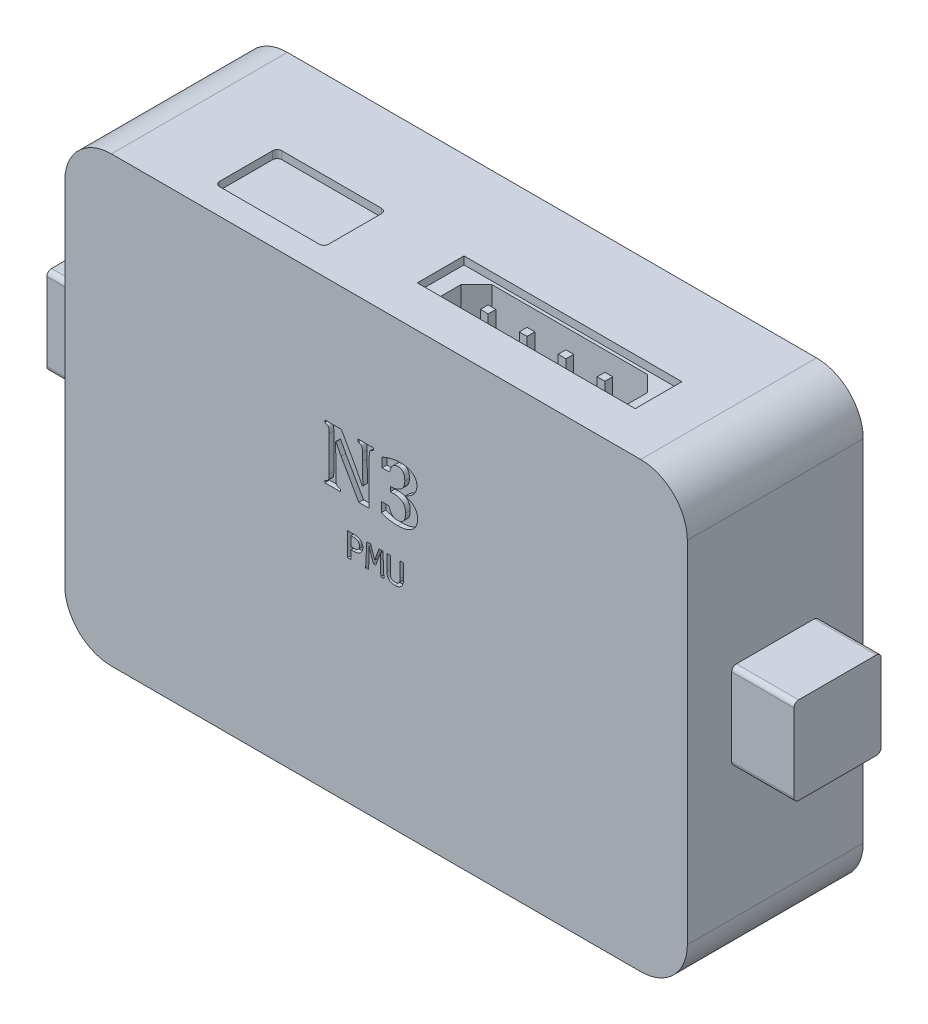
from build123d import *

# Parameters (mm, degrees)
EXTRUDE_1_DEPTH     = 5.65
CUT_EXTRUDE_3_DEPTH = 0.3
EXTRUDE_3_DEPTH     = 4
EXTRUDE_START       = 4
EXTRUDE_4_DEPTH     = 4
UP_CAN_W            = 0.5
UP_CAN_H            = 0.5
CUT_EXTRUDE_5_DEPTH = 4
UP_CAN_3_W          = 14
UP_CAN_3_H          = 3
CUT_EXTRUDE_6_DEPTH = 0.5
CUT_EXTRUDE_7_DEPTH = 0.5


with BuildPart() as part:
    # Main → 凸台-拉伸1 (new, symmetric)
    with BuildSketch(Plane.XY):
        with BuildLine():
            Line((-20, 11.25), (-20, -11.25))
            ThreePointArc((-20, -11.25), (-19.121320344, -13.371320344), (-17, -14.25))
            Line((-17, -14.25), (17, -14.25))
            ThreePointArc((17, -14.25), (19.121320344, -13.371320344), (20, -11.25))
            Line((20, -11.25), (20, 11.25))
            ThreePointArc((20, 11.25), (19.121320344, 13.371320344), (17, 14.25))
            Line((17, 14.25), (-17, 14.25))
            ThreePointArc((-17, 14.25), (-19.121320344, 13.371320344), (-20, 11.25))
        make_face()
    extrude(amount=EXTRUDE_1_DEPTH, both=True)

    # 草图3 → 切除-拉伸3 (cut)
    # profile 1 of 5: a face of its own
    with BuildSketch(Plane.XY.offset(5.65)):
        with BuildLine():
            Line((-0.161653646, 6.307201292), (-0.161653646, 6.161367958))
            add(Edge.make_bspline(
                [(-0.161653646, 6.161367958), (-0.177669577, 6.156235476), (-0.207122243, 6.146797044), (-0.246900488, 6.131171507), (-0.279469724, 6.117829548), (-0.312906932, 6.102024058), (-0.347427448, 6.079192462), (-0.382321405, 6.042359658), (-0.408955266, 5.989839407), (-0.422918392, 5.933915635), (-0.431549055, 5.877250432), (-0.435554473, 5.821903546), (-0.438778121, 5.756314202), (-0.438850306, 5.708935976), (-0.438888889, 5.683611882)],
                knots=[0, 0, 0, 0, 0.975471235, 1.79385316, 2.478592115, 3.017303699, 3.938041953, 4.862988783, 5.927517867, 7.313751775, 8.190433857, 9.251714942, 10.531016607, 12, 12, 12, 12], degree=3))
            Line((-0.438888889, 5.683611882), (-0.438888889, 2.807201292))
            Line((-0.438888889, 2.807201292), (-1.109570312, 2.807201292))
            Line((-1.109570312, 2.807201292), (-2.243576389, 4.802535493))
            add(Edge.make_bspline(
                [(-2.243576389, 4.802535493), (-2.262061977, 4.835447234), (-2.297864844, 4.899190661), (-2.349981257, 4.992106588), (-2.397397164, 5.079949418), (-2.44170538, 5.162098586), (-2.48201379, 5.238793118), (-2.518234642, 5.310060445), (-2.551426649, 5.375634633), (-2.571291416, 5.417976185), (-2.580815972, 5.438277681)],
                knots=[0, 0, 0, 0, 1.258598321, 2.437651948, 3.551981321, 4.586832213, 5.549698172, 6.440681917, 7.252354063, 8, 8, 8, 8], degree=3))
            Line((-2.580815972, 5.438277681), (-2.603602431, 5.438277681))
            add(Edge.make_bspline(
                [(-2.603602431, 5.438277681), (-2.599591716, 5.344101724), (-2.59147488, 5.153509518), (-2.583113042, 4.863596326), (-2.578672736, 4.566077264), (-2.578078581, 4.365036897), (-2.577777778, 4.263255979)],
                knots=[0, 0, 0, 0, 0.96232484, 1.947541814, 2.960899847, 4, 4, 4, 4], degree=3))
            Line((-2.577777778, 4.263255979), (-2.577777778, 3.429271604))
            add(Edge.make_bspline(
                [(-2.577777778, 3.429271604), (-2.577360248, 3.3993976), (-2.576592183, 3.344442964), (-2.574303843, 3.269114776), (-2.568298325, 3.208262066), (-2.558638799, 3.148057851), (-2.535177858, 3.088657172), (-2.499072994, 3.039184043), (-2.457295753, 3.009644248), (-2.414642197, 2.989790918), (-2.361461312, 2.970255391), (-2.321902365, 2.959072708), (-2.300542535, 2.953034625)],
                knots=[0, 0, 0, 0, 1.438978439, 2.647068478, 3.627372042, 4.383140196, 5.576371536, 6.671434312, 7.273846566, 8.020909247, 8.931391092, 10, 10, 10, 10], degree=3))
            Line((-2.300542535, 2.953034625), (-2.300542535, 2.807201292))
            Line((-2.300542535, 2.807201292), (-3.289474826, 2.807201292))
            Line((-3.289474826, 2.807201292), (-3.289474826, 2.953034625))
            add(Edge.make_bspline(
                [(-3.289474826, 2.953034625), (-3.260887566, 2.961497722), (-3.209575028, 2.976688508), (-3.141898216, 3.006316915), (-3.089109373, 3.043258296), (-3.054582463, 3.09524769), (-3.031805913, 3.157665661), (-3.021267721, 3.234246943), (-3.015577407, 3.326622957), (-3.015384102, 3.394316413), (-3.015277778, 3.43155025)],
                knots=[0, 0, 0, 0, 1.149089374, 2.062551405, 2.843955622, 3.594533422, 4.429073491, 5.389328747, 6.564036866, 8, 8, 8, 8], degree=3))
            Line((-3.015277778, 3.43155025), (-3.015277778, 5.682852333))
            add(Edge.make_bspline(
                [(-3.015277778, 5.682852333), (-3.015325243, 5.712984528), (-3.015411829, 5.767951257), (-3.018334, 5.842952579), (-3.023087242, 5.90261003), (-3.032403199, 5.961298476), (-3.054104254, 6.020961153), (-3.091783318, 6.070329356), (-3.134117609, 6.101486773), (-3.176190741, 6.124119037), (-3.229205053, 6.144216392), (-3.268362891, 6.155359926), (-3.289474826, 6.161367958)],
                knots=[0, 0, 0, 0, 1.453211759, 2.650928568, 3.61941141, 4.338124492, 5.512963293, 6.643955544, 7.271627919, 8.036671964, 8.941472357, 10, 10, 10, 10], degree=3))
            Line((-3.289474826, 6.161367958), (-3.289474826, 6.307201292))
            Line((-3.289474826, 6.307201292), (-2.231423611, 6.307201292))
            Line((-2.231423611, 6.307201292), (-1.341232639, 4.730378375))
            add(Edge.make_bspline(
                [(-1.341232639, 4.730378375), (-1.326281235, 4.7032955), (-1.29419107, 4.645167585), (-1.242753958, 4.551273836), (-1.186516622, 4.443784926), (-1.103399271, 4.286116126), (-1.000819197, 4.087585766), (-0.925038386, 3.926245406), (-0.888541667, 3.848542438)],
                knots=[0, 0, 0, 0, 0.561655796, 1.205480602, 1.943652644, 2.764033489, 4.441529425, 6, 6, 6, 6], degree=3))
            Line((-0.888541667, 3.848542438), (-0.84828559, 3.848542438))
            add(Edge.make_bspline(
                [(-0.84828559, 3.848542438), (-0.852568567, 3.954111504), (-0.86132807, 4.170020345), (-0.870286692, 4.500951891), (-0.875728167, 4.846064107), (-0.876165667, 5.080781371), (-0.876388889, 5.200538965)],
                knots=[0, 0, 0, 0, 0.937488971, 1.917343447, 2.937385629, 4, 4, 4, 4], degree=3))
            Line((-0.876388889, 5.200538965), (-0.876388889, 5.682092785))
            add(Edge.make_bspline(
                [(-0.876388889, 5.682092785), (-0.8765491, 5.708169682), (-0.876846263, 5.756537763), (-0.878584804, 5.823462371), (-0.88341317, 5.878643439), (-0.889470731, 5.934140454), (-0.902414163, 5.98793051), (-0.926402611, 6.039529138), (-0.960023933, 6.077406474), (-0.994463834, 6.101933675), (-1.029168865, 6.118696756), (-1.062773812, 6.132948963), (-1.104258254, 6.147203198), (-1.134351907, 6.156404379), (-1.150585937, 6.161367958)],
                knots=[0, 0, 0, 0, 1.50660748, 2.794493175, 3.865833101, 4.705810794, 6.018377177, 7.045366401, 7.95762345, 8.91149549, 9.467497486, 10.181957038, 11.019256184, 12, 12, 12, 12], degree=3))
            Line((-1.150585937, 6.161367958), (-1.150585937, 6.307201292))
            Line((-1.150585937, 6.307201292), (-0.161653646, 6.307201292))
        make_face()
    # profile 2 of 5: a face of its own
    with BuildSketch(Plane.XY.offset(5.65)):
        with BuildLine():
            Line((0.3875, 5.480812403), (0.3875, 6.081615354))
            add(Edge.make_bspline(
                [(0.3875, 6.081615354), (0.440740019, 6.103601001), (0.544910562, 6.14661858), (0.701382153, 6.202099733), (0.853924181, 6.249254445), (1.002588814, 6.288280461), (1.147644136, 6.318087232), (1.288859262, 6.339330677), (1.426551741, 6.352907397), (1.517172623, 6.354854393), (1.561762153, 6.355812403)],
                knots=[0, 0, 0, 0, 1.138871734, 2.228340433, 3.281437788, 4.295392059, 5.266464412, 6.20817041, 7.11833965, 8, 8, 8, 8], degree=3))
            add(Edge.make_bspline(
                [(1.561762153, 6.355812403), (1.612700862, 6.35491021), (1.711831349, 6.353154476), (1.855946997, 6.336134858), (1.991078637, 6.308416711), (2.116218264, 6.268988265), (2.230784195, 6.220083374), (2.332778472, 6.160594215), (2.419627815, 6.088560036), (2.493671249, 6.00797799), (2.55197375, 5.916475895), (2.594306505, 5.815954645), (2.619025084, 5.705807484), (2.62204951, 5.629557521), (2.623611111, 5.590187403)],
                knots=[0, 0, 0, 0, 1.245991689, 2.424791773, 3.545045706, 4.616816666, 5.629595787, 6.587952593, 7.494614438, 8.380594144, 9.255347842, 10.135547138, 11.037327689, 12, 12, 12, 12], degree=3))
            add(Edge.make_bspline(
                [(2.623611111, 5.590187403), (2.622735968, 5.554158468), (2.621031018, 5.483967056), (2.60351275, 5.382098916), (2.57681259, 5.286355946), (2.537203389, 5.197839213), (2.48900985, 5.115118381), (2.431899461, 5.037975403), (2.364854414, 4.966985957), (2.289034787, 4.900407347), (2.202470426, 4.837907658), (2.105401044, 4.776379887), (1.996821144, 4.714672001), (1.91897061, 4.676532146), (1.878493924, 4.65670216)],
                knots=[0, 0, 0, 0, 1.018223358, 1.983698243, 2.915322269, 3.82284993, 4.718315375, 5.619291428, 6.531357531, 7.475260989, 8.469397413, 9.548207294, 10.725243872, 12, 12, 12, 12], degree=3))
            Line((1.878493924, 4.65670216), (1.878493924, 4.633915702))
            add(Edge.make_bspline(
                [(1.878493924, 4.633915702), (1.914332461, 4.626665135), (1.985268492, 4.612313923), (2.088345737, 4.58050901), (2.185825078, 4.538021245), (2.278699343, 4.488413353), (2.364496749, 4.429562042), (2.441580147, 4.36095619), (2.509481243, 4.283301538), (2.567266491, 4.196173322), (2.614853742, 4.101384943), (2.648343733, 3.998239694), (2.668374432, 3.887805197), (2.670917252, 3.811663393), (2.672222222, 3.772587577)],
                knots=[0, 0, 0, 0, 1.026010526, 2.030805963, 3.020916541, 4.0067071, 4.98253303, 5.933933234, 6.895997563, 7.869724968, 8.861364754, 9.863719257, 10.903665134, 12, 12, 12, 12], degree=3))
            add(Edge.make_bspline(
                [(2.672222222, 3.772587577), (2.670475833, 3.724864282), (2.66704771, 3.631184483), (2.639892184, 3.494771243), (2.594916044, 3.366473079), (2.541926714, 3.267301201), (2.491221993, 3.19285027), (2.448082435, 3.140191446), (2.400660821, 3.090064791), (2.347753383, 3.044029038), (2.291156171, 2.999707699), (2.229135573, 2.959567038), (2.162916446, 2.922302126), (2.067455524, 2.87609179), (1.936808858, 2.828026797), (1.766553096, 2.787465527), (1.580692314, 2.763117955), (1.451703991, 2.760136765), (1.384787326, 2.758590181)],
                knots=[0, 0, 0, 0, 1.238691166, 2.431524098, 3.596131476, 4.758044184, 5.339846471, 5.93341988, 6.524072501, 7.129652346, 7.75306838, 8.389559096, 9.046112197, 9.725450149, 11.142277535, 12.650970423, 14.262587788, 16, 16, 16, 16], degree=3))
            add(Edge.make_bspline(
                [(1.384787326, 2.758590181), (1.33716922, 2.759092718), (1.242335341, 2.760093546), (1.100704382, 2.77068084), (0.960201974, 2.786104278), (0.822458508, 2.809197191), (0.689307329, 2.836258219), (0.564478721, 2.871187031), (0.447273325, 2.907813905), (0.374357917, 2.939258022), (0.338888889, 2.954553722)],
                knots=[0, 0, 0, 0, 1.066585531, 2.124159315, 3.180226203, 4.232065357, 5.252166273, 6.22223498, 7.135222593, 8, 8, 8, 8], degree=3))
            Line((0.338888889, 2.954553722), (0.338888889, 3.58497907))
            Line((0.338888889, 3.58497907), (0.825, 3.58497907))
            add(Edge.make_bspline(
                [(0.825, 3.58497907), (0.837189747, 3.541105853), (0.860202393, 3.458278966), (0.907565053, 3.345919547), (0.960730451, 3.251565392), (1.023417455, 3.176118777), (1.096067092, 3.1186378), (1.17921829, 3.079163153), (1.27189704, 3.053713903), (1.337265875, 3.051436264), (1.371115451, 3.050256847)],
                knots=[0, 0, 0, 0, 1.305930177, 2.46542516, 3.491309853, 4.404185451, 5.263440125, 6.128056862, 7.030662191, 8, 8, 8, 8], degree=3))
            add(Edge.make_bspline(
                [(1.371115451, 3.050256847), (1.392164121, 3.050525579), (1.433176166, 3.051049186), (1.492609065, 3.059994493), (1.548059007, 3.072660712), (1.599916425, 3.08987362), (1.646929411, 3.113950828), (1.690785253, 3.141776376), (1.729796272, 3.17587504), (1.765072714, 3.214651632), (1.795252278, 3.259235831), (1.822079278, 3.308261952), (1.84498521, 3.362385836), (1.86284081, 3.422079304), (1.877484799, 3.486747686), (1.886829861, 3.556659277), (1.893110212, 3.631450873), (1.893990014, 3.682946718), (1.894444444, 3.709545042)],
                knots=[0, 0, 0, 0, 1.04932923, 2.044553753, 2.991534269, 3.886518749, 4.762302477, 5.620875306, 6.471885114, 7.33961212, 8.229767994, 9.151377203, 10.125200033, 11.156267991, 12.256683227, 13.430583075, 14.672860224, 16, 16, 16, 16], degree=3))
            add(Edge.make_bspline(
                [(1.894444444, 3.709545042), (1.893923242, 3.738186103), (1.89291031, 3.793848689), (1.883337619, 3.874279752), (1.86974041, 3.949330349), (1.847881869, 4.01803446), (1.821530947, 4.08166875), (1.788878631, 4.139746911), (1.749657985, 4.191956714), (1.704456283, 4.238582024), (1.653392593, 4.280010236), (1.595481177, 4.314755171), (1.532454678, 4.345537522), (1.462480649, 4.369654454), (1.386682245, 4.388295691), (1.304717529, 4.402234305), (1.216545131, 4.409308719), (1.155667314, 4.410667171), (1.124262153, 4.411367958)],
                knots=[0, 0, 0, 0, 1.148071931, 2.231225072, 3.24480356, 4.201827953, 5.116438562, 6.003060875, 6.866114256, 7.727792825, 8.601530905, 9.494871905, 10.430378815, 11.409816751, 12.456422708, 13.558120058, 14.740302521, 16, 16, 16, 16], degree=3))
            Line((1.124262153, 4.411367958), (0.922222222, 4.411367958))
            Line((0.922222222, 4.411367958), (0.922222222, 4.703034625))
            add(Edge.make_bspline(
                [(0.922222222, 4.703034625), (0.958968977, 4.705139352), (1.030367567, 4.709228815), (1.133861524, 4.722240965), (1.23055265, 4.740320703), (1.320626575, 4.763556545), (1.403485769, 4.793092305), (1.479437046, 4.828332616), (1.548758592, 4.868519375), (1.611744672, 4.91395593), (1.666592564, 4.966251749), (1.714960843, 5.023269571), (1.755313557, 5.08630896), (1.789037602, 5.154188993), (1.814991128, 5.227900214), (1.832889709, 5.306920191), (1.84365028, 5.391396436), (1.845090515, 5.449385024), (1.845833333, 5.479293306)],
                knots=[0, 0, 0, 0, 1.294124326, 2.514471056, 3.665273782, 4.75157949, 5.782351101, 6.754339568, 7.691995305, 8.596689159, 9.478484644, 10.35060716, 11.219952716, 12.103948147, 13.010742687, 13.961079669, 14.948403386, 16, 16, 16, 16], degree=3))
            add(Edge.make_bspline(
                [(1.845833333, 5.479293306), (1.845601673, 5.502594758), (1.845150288, 5.547997268), (1.839954798, 5.613741137), (1.83057941, 5.675058041), (1.818822186, 5.732052988), (1.803003196, 5.784774609), (1.782835695, 5.832799392), (1.760733292, 5.877171582), (1.73337706, 5.916086132), (1.704254924, 5.951346789), (1.670709149, 5.981313719), (1.634583481, 6.007411811), (1.594305126, 6.027641831), (1.551844133, 6.044876462), (1.505510174, 6.05596297), (1.456147632, 6.06293274), (1.422030494, 6.063734567), (1.40453559, 6.064145736)],
                knots=[0, 0, 0, 0, 1.342415624, 2.615675512, 3.795773904, 4.914495864, 5.966655767, 6.960891649, 7.913479791, 8.815817395, 9.695585522, 10.542445334, 11.400538855, 12.255277765, 13.132987386, 14.03520706, 14.992475158, 16, 16, 16, 16], degree=3))
            add(Edge.make_bspline(
                [(1.40453559, 6.064145736), (1.384491939, 6.063635193), (1.344910756, 6.062626999), (1.286744903, 6.052384063), (1.230852682, 6.035654563), (1.177220657, 6.011801627), (1.12508323, 5.980681479), (1.077488635, 5.937936797), (1.032105503, 5.886198705), (0.989775583, 5.824689739), (0.951803541, 5.75319374), (0.920110747, 5.671187624), (0.892637928, 5.57984619), (0.880107507, 5.514625874), (0.873611111, 5.480812403)],
                knots=[0, 0, 0, 0, 0.831492998, 1.641990067, 2.443438678, 3.248189408, 4.073881454, 4.952981561, 5.891417605, 6.926545987, 8.045740153, 9.244265423, 10.571289508, 12, 12, 12, 12], degree=3))
            Line((0.873611111, 5.480812403), (0.3875, 5.480812403))
        make_face()
    # profile 3 of 5: a face of its own
    with BuildSketch(Plane.XY.offset(5.65)):
        with BuildLine():
            add(Edge.make_bspline(
                [(-0.847826087, 0.416844572), (-0.84819317, 0.401649218), (-0.848930636, 0.371121882), (-0.855738904, 0.325548058), (-0.866281469, 0.280218449), (-0.880763763, 0.235431129), (-0.899756752, 0.191847749), (-0.9234907, 0.150245177), (-0.952503811, 0.111404926), (-0.985323881, 0.074500096), (-1.023271409, 0.040770279), (-1.066164851, 0.010379421), (-1.11388272, -0.016677028), (-1.166281838, -0.040753728), (-1.224049093, -0.059647666), (-1.287024222, -0.073668349), (-1.355431007, -0.081685229), (-1.402832275, -0.082654768), (-1.427309783, -0.083155428)],
                knots=[0, 0, 0, 0, 0.84837333, 1.704374698, 2.568122001, 3.446177459, 4.329841521, 5.219461111, 6.115085959, 7.03322926, 7.973947317, 8.94447037, 9.964314875, 11.034235969, 12.160282575, 13.352588404, 14.632904974, 16, 16, 16, 16], degree=3))
            Line((-1.427309783, -0.083155428), (-1.608695652, -0.083155428))
            Line((-1.608695652, -0.083155428), (-1.608695652, -0.626633689))
            Line((-1.608695652, -0.626633689), (-1.826086957, -0.626633689))
            Line((-1.826086957, -0.626633689), (-1.826086957, 0.873366311))
            Line((-1.826086957, 0.873366311), (-1.406589674, 0.873366311))
            add(Edge.make_bspline(
                [(-1.406589674, 0.873366311), (-1.388348098, 0.873173118), (-1.352140258, 0.872789648), (-1.298530288, 0.867656163), (-1.24595711, 0.860424508), (-1.194848716, 0.849613458), (-1.145773697, 0.835429928), (-1.099150438, 0.818117241), (-1.056266715, 0.795536157), (-1.015997662, 0.770232699), (-0.978911032, 0.741023), (-0.946284546, 0.70712553), (-0.917509513, 0.669363297), (-0.892587836, 0.627825076), (-0.872068737, 0.581807134), (-0.858278341, 0.53081996), (-0.849020504, 0.475378026), (-0.848233561, 0.436813189), (-0.847826087, 0.416844572)],
                knots=[0, 0, 0, 0, 1.071095419, 2.126025337, 3.160633674, 4.187194637, 5.191188192, 6.159546808, 7.102471747, 8.032359578, 8.950543616, 9.867691343, 10.788184798, 11.733733012, 12.707489344, 13.737062018, 14.82826569, 16, 16, 16, 16], degree=3))
        make_face()
        with BuildLine():
            add(Edge.make_bspline(
                [(-1.065217391, 0.405295659), (-1.065434245, 0.416860055), (-1.065856902, 0.439399495), (-1.070400235, 0.472041011), (-1.077554701, 0.502638253), (-1.087300118, 0.531164705), (-1.099933708, 0.557705281), (-1.115730491, 0.581896924), (-1.134189983, 0.604244549), (-1.15562493, 0.624221094), (-1.179614177, 0.641805477), (-1.205437631, 0.657700678), (-1.233927854, 0.670545369), (-1.264692857, 0.680957945), (-1.29756274, 0.689613835), (-1.332856198, 0.695061141), (-1.370150823, 0.699105706), (-1.395821206, 0.699335557), (-1.408967391, 0.699453268)],
                knots=[0, 0, 0, 0, 1.07893025, 2.102875295, 3.069403633, 4.00867391, 4.911619206, 5.805799344, 6.69897942, 7.61127936, 8.532960211, 9.47193309, 10.436783978, 11.442898866, 12.50165651, 13.605056338, 14.773513735, 16, 16, 16, 16], degree=3))
            Line((-1.408967391, 0.699453268), (-1.608695652, 0.699453268))
            Line((-1.608695652, 0.699453268), (-1.608695652, 0.090757616))
            Line((-1.608695652, 0.090757616), (-1.426290761, 0.090757616))
            add(Edge.make_bspline(
                [(-1.426290761, 0.090757616), (-1.412244658, 0.091062272), (-1.385016773, 0.091652838), (-1.345272556, 0.094962764), (-1.30797301, 0.100916247), (-1.273287228, 0.109871819), (-1.241065891, 0.120684194), (-1.21125147, 0.133891853), (-1.18399768, 0.149977666), (-1.159090552, 0.16831263), (-1.136701838, 0.189072592), (-1.117686016, 0.212815949), (-1.101229752, 0.238715211), (-1.087853457, 0.267239501), (-1.07784145, 0.29833586), (-1.07032595, 0.331741516), (-1.065857166, 0.367697012), (-1.06543532, 0.392488325), (-1.065217391, 0.405295659)],
                knots=[0, 0, 0, 0, 1.232805628, 2.389751021, 3.4973379, 4.54330244, 5.530003372, 6.477393866, 7.399377973, 8.301660217, 9.187431021, 10.070466494, 10.963674817, 11.874940633, 12.827061481, 13.825105319, 14.876436953, 16, 16, 16, 16], degree=3))
        make_face(mode=Mode.SUBTRACT)
    # profile 4 of 5: a face of its own
    with BuildSketch(Plane.XY.offset(5.65)):
        Polygon((0.503736413, -0.626633689), (0.304347826, -0.626633689), (0.281589674, 0.324453268), (0.27173913, 0.66582555), (0.200747283, 0.46270055), (-0.023777174, -0.148372819), (-0.165081522, -0.148372819), (-0.375679348, 0.439602724), (-0.445652174, 0.66582555), (-0.450407609, 0.30814892), (-0.47826087, -0.626633689), (-0.670855978, -0.626633689), (-0.596127717, 0.873366311), (-0.353940217, 0.873366311), (-0.152173913, 0.29252392), (-0.086956522, 0.096532072), (-0.022758152, 0.29252392), (0.192595109, 0.873366311), (0.441236413, 0.873366311), align=None)
    # profile 5 of 5: a face of its own
    with BuildSketch(Plane.XY.offset(5.65)):
        with BuildLine():
            add(Edge.make_bspline(
                [(1.760869565, -0.105234232), (1.760365653, -0.125403124), (1.759377855, -0.164939402), (1.753031381, -0.222830508), (1.741766426, -0.277713792), (1.72626586, -0.329532061), (1.70608661, -0.377939856), (1.682117177, -0.422952161), (1.653565214, -0.464156537), (1.620965696, -0.501635976), (1.584040711, -0.535015576), (1.543381306, -0.564420078), (1.498761676, -0.589599391), (1.45055646, -0.611184127), (1.398287859, -0.627575333), (1.342543642, -0.64001614), (1.282903192, -0.647063245), (1.241865891, -0.647928435), (1.220788043, -0.648372819)],
                knots=[0, 0, 0, 0, 1.11533168, 2.186340517, 3.215329593, 4.209637775, 5.172397981, 6.11082755, 7.024364469, 7.938480506, 8.851566745, 9.770835784, 10.707404611, 11.680049096, 12.68592053, 13.731069016, 14.834616795, 16, 16, 16, 16], degree=3))
            add(Edge.make_bspline(
                [(1.220788043, -0.648372819), (1.197786509, -0.647923833), (1.153600781, -0.647061335), (1.08994305, -0.640310155), (1.031718513, -0.628881716), (0.978599395, -0.613029084), (0.930752212, -0.592489742), (0.887561283, -0.568268154), (0.848868581, -0.540397585), (0.814923398, -0.508478152), (0.785540125, -0.472943103), (0.760738306, -0.433904199), (0.739751961, -0.391716976), (0.723254861, -0.346086886), (0.710827523, -0.297467539), (0.702104836, -0.246110614), (0.696478374, -0.192090034), (0.695931628, -0.155067588), (0.695652174, -0.136144558)],
                knots=[0, 0, 0, 0, 1.312563004, 2.521420972, 3.648051293, 4.694693708, 5.678954229, 6.613532698, 7.515738083, 8.393474785, 9.265531829, 10.140290115, 11.027490559, 11.949473662, 12.903968408, 13.887719697, 14.920364614, 16, 16, 16, 16], degree=3))
            Line((0.695652174, -0.136144558), (0.695652174, 0.873366311))
            Line((0.695652174, 0.873366311), (0.913043478, 0.873366311))
            Line((0.913043478, 0.873366311), (0.913043478, -0.118141841))
            add(Edge.make_bspline(
                [(0.913043478, -0.118141841), (0.913222298, -0.132414306), (0.913567608, -0.15997516), (0.916690704, -0.2000075), (0.921678216, -0.23734779), (0.928746025, -0.272122592), (0.937987085, -0.304405457), (0.950854599, -0.333536763), (0.965267227, -0.360557492), (0.983171269, -0.384421975), (1.003553065, -0.40559714), (1.026804648, -0.423898881), (1.052708015, -0.439495786), (1.081488148, -0.45256766), (1.113486829, -0.462321525), (1.148532491, -0.469293987), (1.186927202, -0.473876786), (1.213640658, -0.474259861), (1.227581522, -0.474459776)],
                knots=[0, 0, 0, 0, 1.246642402, 2.407329763, 3.505429403, 4.535490685, 5.505633834, 6.431662104, 7.312644057, 8.175164385, 9.028562083, 9.873549447, 10.752251869, 11.664173984, 12.627739815, 13.667491001, 14.782741197, 16, 16, 16, 16], degree=3))
            add(Edge.make_bspline(
                [(1.227581522, -0.474459776), (1.240613896, -0.474233021), (1.265966268, -0.473791906), (1.302614155, -0.469420361), (1.336572195, -0.461826538), (1.368014497, -0.45183616), (1.396702702, -0.438476715), (1.422862899, -0.422359821), (1.446501471, -0.403394154), (1.46693785, -0.380903443), (1.484964153, -0.356016187), (1.500636261, -0.328672144), (1.513889746, -0.298957311), (1.524746491, -0.266879263), (1.533169271, -0.232438073), (1.539339725, -0.1956653), (1.542557769, -0.156468939), (1.543165771, -0.12958264), (1.543478261, -0.115764124)],
                knots=[0, 0, 0, 0, 1.143906156, 2.225283924, 3.233450169, 4.19541835, 5.116075032, 6.004390991, 6.887798474, 7.767169552, 8.663955608, 9.581332573, 10.529122189, 11.516238804, 12.550580461, 13.639017649, 14.7865465, 16, 16, 16, 16], degree=3))
            Line((1.543478261, -0.115764124), (1.543478261, 0.873366311))
            Line((1.543478261, 0.873366311), (1.760869565, 0.873366311))
            Line((1.760869565, 0.873366311), (1.760869565, -0.105234232))
        make_face()
    extrude(amount=-CUT_EXTRUDE_3_DEPTH, mode=Mode.SUBTRACT)

    # 草图6 → 凸台-拉伸3 (add)
    with BuildSketch(Plane(origin=(20, 0, 0), x_dir=(0, 0, -1), z_dir=(1, 0, 0))):
        with BuildLine():
            Line((-2.5, 2.8), (2.5, 2.8))
            ThreePointArc((2.5, 2.8), (2.712132034, 2.712132034), (2.8, 2.5))
            Line((2.8, 2.5), (2.8, -2.5))
            ThreePointArc((2.8, -2.5), (2.712132034, -2.712132034), (2.5, -2.8))
            Line((2.5, -2.8), (-2.5, -2.8))
            ThreePointArc((-2.5, -2.8), (-2.712132034, -2.712132034), (-2.8, -2.5))
            Line((-2.8, -2.5), (-2.8, 2.5))
            ThreePointArc((-2.8, 2.5), (-2.712132034, 2.712132034), (-2.5, 2.8))
        make_face()
    extrude(amount=EXTRUDE_3_DEPTH)

    # 草图7 → 凸台-拉伸4 (add)
    with BuildSketch(Plane.ZY.offset(20).offset(EXTRUDE_START)):
        with BuildLine():
            Line((-2.5, 2.8), (2.5, 2.8))
            ThreePointArc((2.5, 2.8), (2.712132034, 2.712132034), (2.8, 2.5))
            Line((2.8, 2.5), (2.8, -2.5))
            ThreePointArc((2.8, -2.5), (2.712132034, -2.712132034), (2.5, -2.8))
            Line((2.5, -2.8), (-2.5, -2.8))
            ThreePointArc((-2.5, -2.8), (-2.712132034, -2.712132034), (-2.8, -2.5))
            Line((-2.8, -2.5), (-2.8, 2.5))
            ThreePointArc((-2.8, 2.5), (-2.712132034, 2.712132034), (-2.5, 2.8))
        make_face()
    extrude(amount=-EXTRUDE_4_DEPTH)

    # UP_CAN → 切除-拉伸5 (cut)
    with BuildSketch(Plane(origin=(0, 14.25, 0), x_dir=(-1, 0, 0), z_dir=(0, 1, 0))):
        Polygon((-1, 1.2), (-1, 2.7), (-13, 2.7), (-13, 1.2), (-12, 0.2), (-2, 0.2), align=None)
        with Locations((-10.75, 1.7)):
            Rectangle(UP_CAN_W, UP_CAN_H, mode=Mode.SUBTRACT)
        with Locations((-8.25, 1.7)):
            Rectangle(UP_CAN_W, UP_CAN_H, mode=Mode.SUBTRACT)
        with Locations((-5.75, 1.7)):
            Rectangle(UP_CAN_W, UP_CAN_H, mode=Mode.SUBTRACT)
        with Locations((-3.25, 1.7)):
            Rectangle(UP_CAN_W, UP_CAN_H, mode=Mode.SUBTRACT)
    extrude(amount=-CUT_EXTRUDE_5_DEPTH, mode=Mode.SUBTRACT)

    # UP_CAN<3> → 切除-拉伸6 (cut)
    with BuildSketch(Plane(origin=(0, 14.25, 0), x_dir=(-1, 0, 0), z_dir=(0, 1, 0))):
        with Locations((-7, 1.5)):
            Rectangle(UP_CAN_3_W, UP_CAN_3_H)
    extrude(amount=-CUT_EXTRUDE_6_DEPTH, mode=Mode.SUBTRACT)

    # Up_iBat → 切除-拉伸7 (cut)
    with BuildSketch(Plane(origin=(0, 14.25, 0), x_dir=(1, 0, 0), z_dir=(0, 1, 0))):
        with BuildLine():
            Line((-11.7, 0), (-5.3, 0))
            ThreePointArc((-5.3, 0), (-5.087867966, -0.087867966), (-5, -0.3))
            Line((-5, -0.3), (-5, -3.7))
            ThreePointArc((-5, -3.7), (-5.087867966, -3.912132034), (-5.3, -4))
            Line((-5.3, -4), (-11.7, -4))
            ThreePointArc((-11.7, -4), (-11.912132034, -3.912132034), (-12, -3.7))
            Line((-12, -3.7), (-12, -0.3))
            ThreePointArc((-12, -0.3), (-11.912132034, -0.087867966), (-11.7, 0))
        make_face()
    extrude(amount=-CUT_EXTRUDE_7_DEPTH, mode=Mode.SUBTRACT)


solid = part.part
